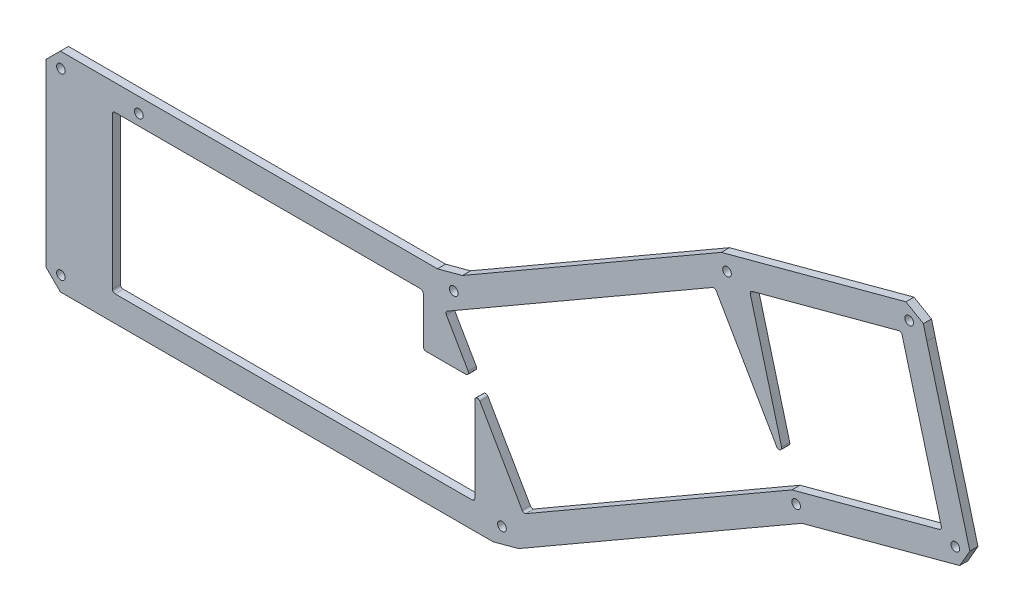
from build123d import *

# Parameters (mm, degrees)
ESQUISSE1_R        = 1.6
BOSS_EXTRU_1_DEPTH = 3


with BuildPart() as part:
    # Esquisse1 → Boss.-Extru.1 (new body)
    with BuildSketch(Plane.XY):
        Polygon((-75.988646329, 49.585106383), (-95.960869343, 49.585106383), (-101.253762562, 44.292213164), (-101.253762562, 35.79522772), (-101.253762562, -22.122000398), (-95.960869343, -27.414893617), (63.734552111, -27.414893617), (73.191845678, -24.880819443), (177.743787613, 35.482272378), (236.017194438, 51.096584676), (239.759835125, 57.579028501), (228.577013006, 99.31388882), (223.918643626, 116.699160027), (222.600104344, 121.736116557), (216.144691957, 125.488029577), (211.058449045, 124.125174896), (148.022896982, 107.234849626), (52.44172146, 52.051032209), (43.238760989, 49.585106383), align=None)
        with Locations((-95.753762562, 44.085106383)):
            Circle(ESQUISSE1_R, mode=Mode.SUBTRACT)
        with Locations((-66.988646329, 44.085106383)):
            Circle(ESQUISSE1_R, mode=Mode.SUBTRACT)
        with Locations((-95.753762562, -21.914893617)):
            Circle(ESQUISSE1_R, mode=Mode.SUBTRACT)
        with Locations((67.039694146, -20.835264486)):
            Circle(ESQUISSE1_R, mode=Mode.SUBTRACT)
        with Locations((49.263745973, 45.505477252)):
            Circle(ESQUISSE1_R, mode=Mode.SUBTRACT)
        with Locations((150.12930694, 102.149526137)):
            Circle(ESQUISSE1_R, mode=Mode.SUBTRACT)
        with Locations((217.363403759, 120.120565138)):
            Circle(ESQUISSE1_R, mode=Mode.SUBTRACT)
        with Locations((234.393639901, 56.355573542)):
            Circle(ESQUISSE1_R, mode=Mode.SUBTRACT)
        with Locations((175.637377655, 40.567595866)):
            Circle(ESQUISSE1_R, mode=Mode.SUBTRACT)
        with BuildLine():
            Line((-76.753762562, 39.085106383), (-76.753762562, -16.914893617))
            ThreePointArc((-76.753762562, -16.914893617), (-76.460869343, -17.622000398), (-75.753762562, -17.914893617))
            Line((-75.753762562, -17.914893617), (56.011353671, -17.914893617))
            ThreePointArc((56.011353671, -17.914893617), (56.718460453, -17.622000398), (57.011353671, -16.914893617))
            Line((57.011353671, -16.914893617), (57.011353671, 14.621004768))
            ThreePointArc((57.011353671, 14.621004768), (57.752534626, 15.586930594), (58.877379075, 15.121004768))
            Line((58.877379075, 15.121004768), (74.527293708, -11.98544251))
            ThreePointArc((74.527293708, -11.98544251), (75.134500067, -12.451368337), (75.893319112, -12.351467914))
            Line((75.893319112, -12.351467914), (174.076924484, 44.334863077))
            Line((174.076924484, 44.334863077), (228.528734589, 58.925181621))
            ThreePointArc((228.528734589, 58.925181621), (229.135940948, 59.391107448), (229.235841371, 60.149926493))
            Line((229.235841371, 60.149926493), (214.741974845, 114.241772765))
            ThreePointArc((214.741974845, 114.241772765), (214.276049019, 114.848979124), (213.517229973, 114.948879546))
            Line((213.517229973, 114.948879546), (159.425383701, 100.45501302))
            ThreePointArc((159.425383701, 100.45501302), (158.818177343, 99.989087194), (158.71827692, 99.230268149))
            Line((158.71827692, 99.230268149), (170.271736655, 56.112169417))
            ThreePointArc((170.271736655, 56.112169417), (169.688494261, 54.929470839), (168.439785425, 55.353350371))
            Line((168.439785425, 55.353350371), (146.120215143, 94.011980101))
            ThreePointArc((146.120215143, 94.011980101), (145.513008785, 94.477905928), (144.75418974, 94.378005505))
            Line((144.75418974, 94.378005505), (46.893319112, 37.878005505))
            ThreePointArc((46.893319112, 37.878005505), (46.427393286, 37.270799147), (46.527293708, 36.511980101))
            Line((46.527293708, 36.511980101), (54.567977999, 22.585106383))
            ThreePointArc((54.567977999, 22.585106383), (54.567977999, 21.585106383), (53.701952595, 21.085106383))
            Line((53.701952595, 21.085106383), (39.011353671, 21.085106383))
            ThreePointArc((39.011353671, 21.085106383), (38.30424689, 21.377999602), (38.011353671, 22.085106383))
            Line((38.011353671, 22.085106383), (38.011353671, 39.085106383))
            ThreePointArc((38.011353671, 39.085106383), (37.718460453, 39.792213164), (37.011353671, 40.085106383))
            Line((37.011353671, 40.085106383), (-75.753762562, 40.085106383))
            ThreePointArc((-75.753762562, 40.085106383), (-76.460869343, 39.792213164), (-76.753762562, 39.085106383))
        make_face(mode=Mode.SUBTRACT)
    extrude(amount=BOSS_EXTRU_1_DEPTH)


solid = part.part
